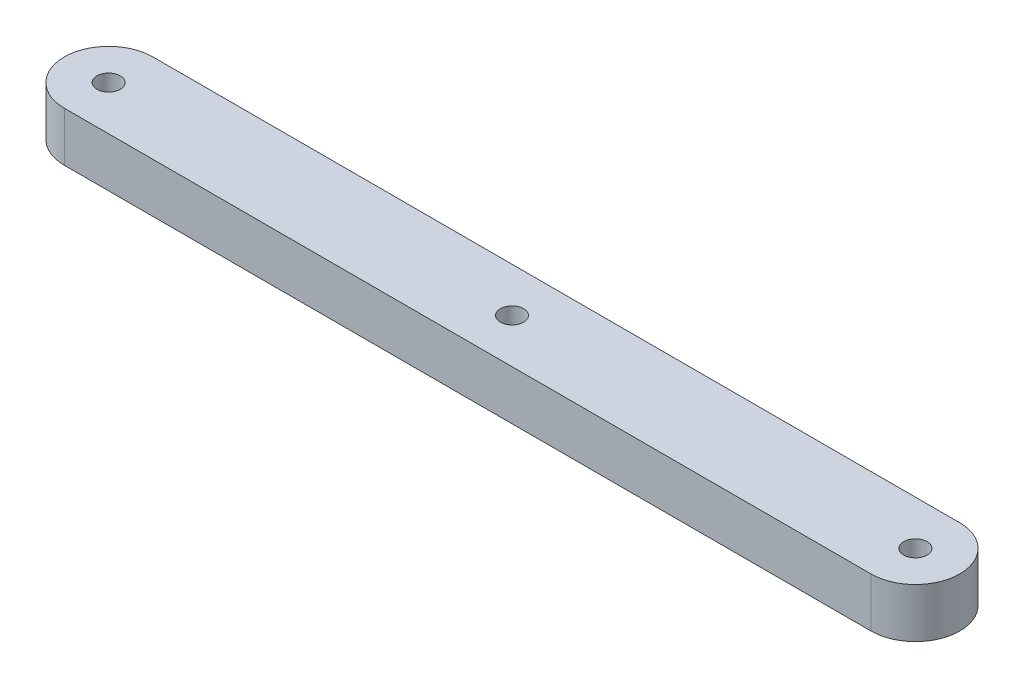
from build123d import *

# Parameters (mm, degrees)
SKETCH1_R           = 2.1
BOSS_EXTRUDE1_DEPTH = 8.89


with BuildPart() as part:
    # Sketch1 → Boss-Extrude1 (new body)
    with BuildSketch(Plane(origin=(0, 0, 0), x_dir=(1, 0, 0), z_dir=(0, 1, 0))):
        with BuildLine():
            Line((0, 7.973476097), (145.04, 7.973476097))
            ThreePointArc((145.04, 7.973476097), (153.013476097, 0), (145.04, -7.973476097))
            Line((145.04, -7.973476097), (0, -7.973476097))
            ThreePointArc((0, -7.973476097), (-7.973476097, 0), (0, 7.973476097))
        make_face()
        with Locations(Location((145.04, 0, 0), (0, 0, 90))):
            Circle(SKETCH1_R, mode=Mode.SUBTRACT)
        with Locations(Location((72.52, 0, 0), (0, 0, 90))):
            Circle(SKETCH1_R, mode=Mode.SUBTRACT)
        with Locations(Location((0, 0, 0), (0, 0, 90))):
            Circle(SKETCH1_R, mode=Mode.SUBTRACT)
    extrude(amount=BOSS_EXTRUDE1_DEPTH)


solid = part.part
